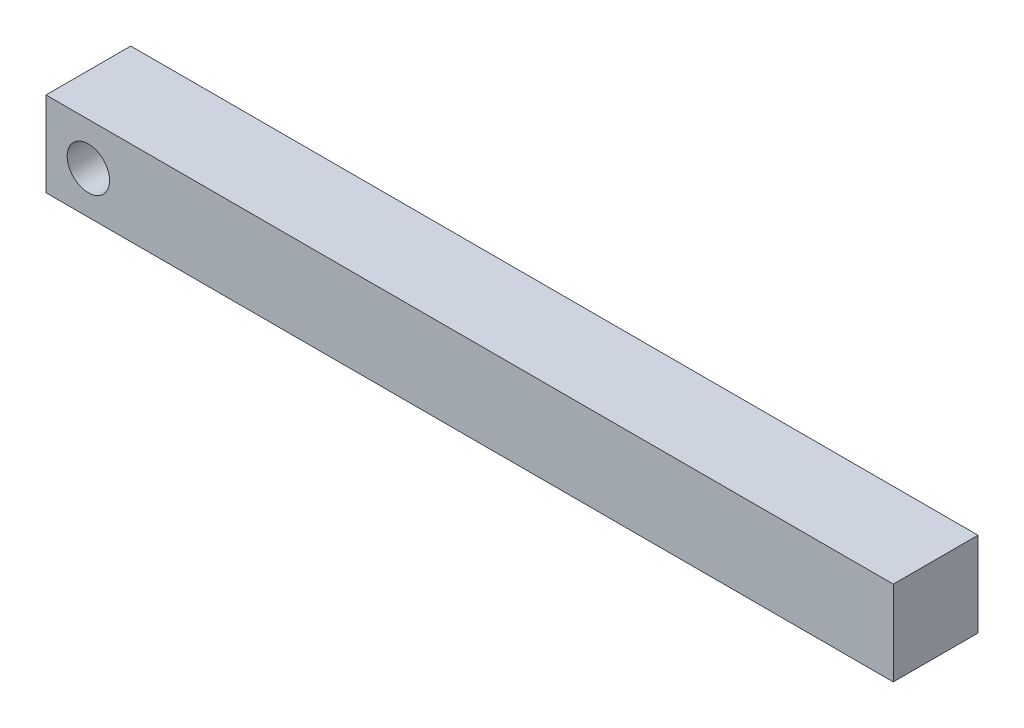
from build123d import *

# Parameters (mm, degrees)
SKETCH1_W           = 200
SKETCH1_H           = 20
BOSS_EXTRUDE2_DEPTH = 20
SKETCH3_R           = 5
CUT_EXTRUDE1_DEPTH  = 103.46950766


with BuildPart() as part:
    # Sketch1 → Boss-Extrude2 (new body)
    with BuildSketch(Plane.XY):
        Rectangle(SKETCH1_W, SKETCH1_H)
    extrude(amount=BOSS_EXTRUDE2_DEPTH)

    # Sketch3 → Cut-Extrude1 (cut, through all)
    with BuildSketch(Plane.XY.offset(20)):
        with Locations((-90, 0)):
            Circle(SKETCH3_R)
    extrude(amount=-CUT_EXTRUDE1_DEPTH, mode=Mode.SUBTRACT)


solid = part.part
